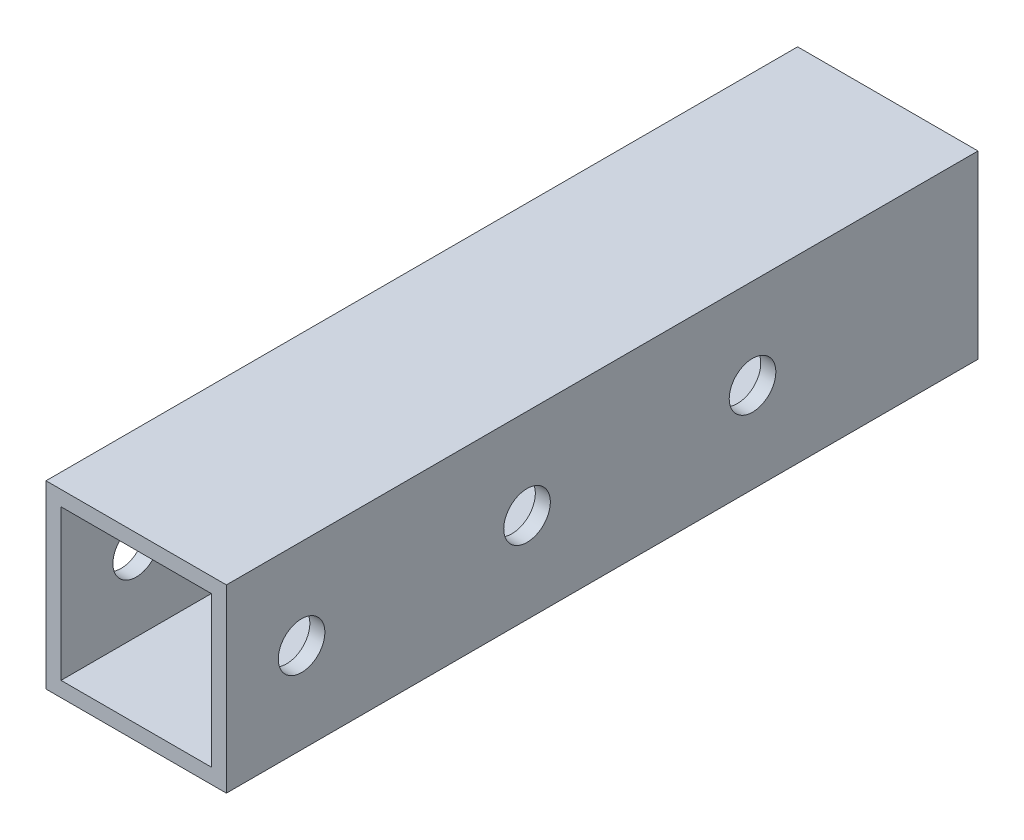
from build123d import *

# Parameters (mm, degrees)
SKETCH_1_W          = 12
SKETCH_1_H          = 12
SKETCH_1_W_2        = 10
SKETCH_1_H_2        = 10
EXTRUDE_1_DEPTH     = 50
SKETCH_3_R          = 1.55
CUT_EXTRUDE_1_DEPTH = 53.80151513


with BuildPart() as part:
    # 草图1 → 凸台-拉伸1 (new body)
    with BuildSketch(Plane.XY):
        with Locations((6, 6)):
            Rectangle(SKETCH_1_W, SKETCH_1_H)
        with Locations((6, 6)):
            Rectangle(SKETCH_1_W_2, SKETCH_1_H_2, mode=Mode.SUBTRACT)
    extrude(amount=EXTRUDE_1_DEPTH)

    # 草图3 → 切除-拉伸1 (cut, through all)
    with BuildSketch(Plane.ZY):
        with Locations((15, 6)):
            Circle(SKETCH_3_R)
        with Locations((30, 6)):
            Circle(SKETCH_3_R)
        with Locations((45, 6)):
            Circle(SKETCH_3_R)
    extrude(amount=-CUT_EXTRUDE_1_DEPTH, mode=Mode.SUBTRACT)


solid = part.part
